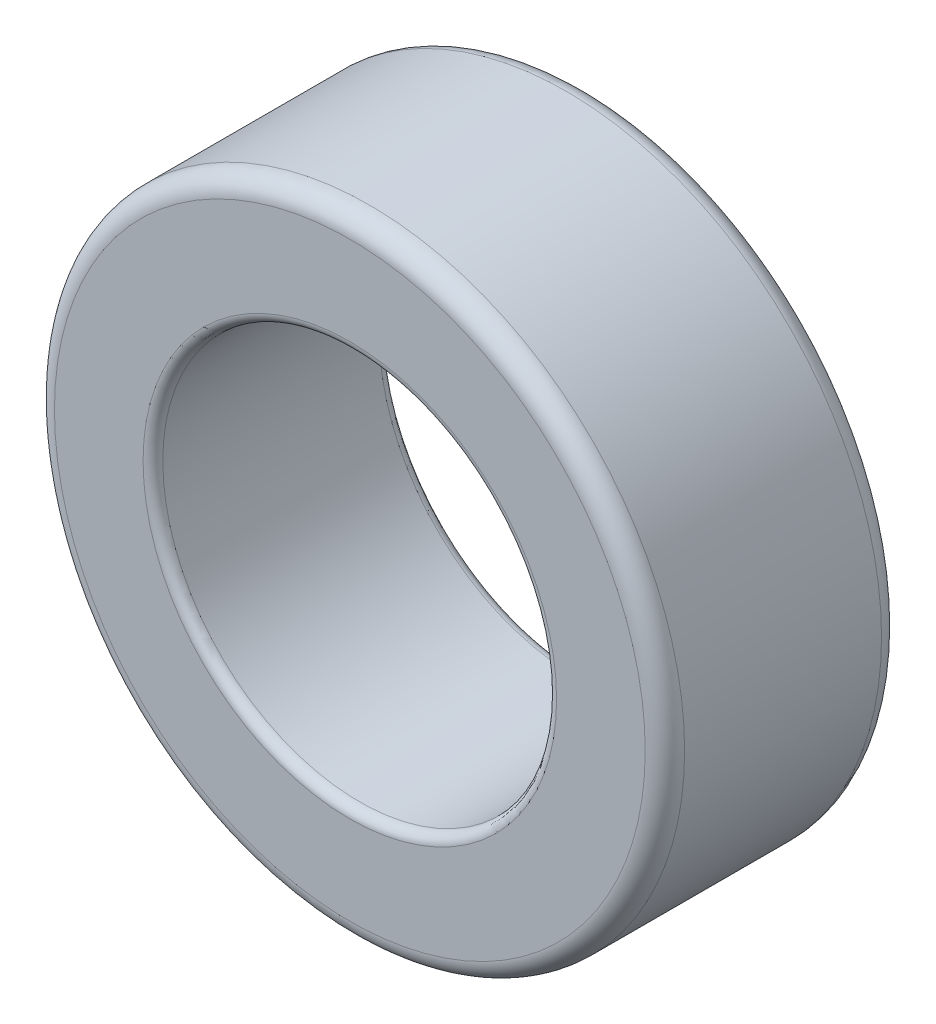
from build123d import *

# Parameters (mm, degrees)
SKETCH_1_R      = 16
SKETCH_1_R_2    = 10
EXTRUDE_4_DEPTH = 6
FILLET_1_R      = 1
FILLET_2_R      = 0.5


with BuildPart() as part:
    # 草图1 → 凸台-拉伸4 (new, symmetric)
    with BuildSketch(Plane.XY):
        Circle(SKETCH_1_R)
        Circle(SKETCH_1_R_2, mode=Mode.SUBTRACT)
    extrude(amount=EXTRUDE_4_DEPTH, both=True)

    # 圆角1
    fillet_1_edges = [part.edges().sort_by_distance(p)[0] for p in [
        (-16, 0, 6),
        (-16, 0, -6),
    ]]
    fillet(fillet_1_edges, radius=FILLET_1_R)

    # 圆角2
    fillet_2_edges = [part.edges().sort_by_distance(p)[0] for p in [
        (-10, 0, -6),
        (-10, 0, 6),
    ]]
    fillet(fillet_2_edges, radius=FILLET_2_R)


solid = part.part
